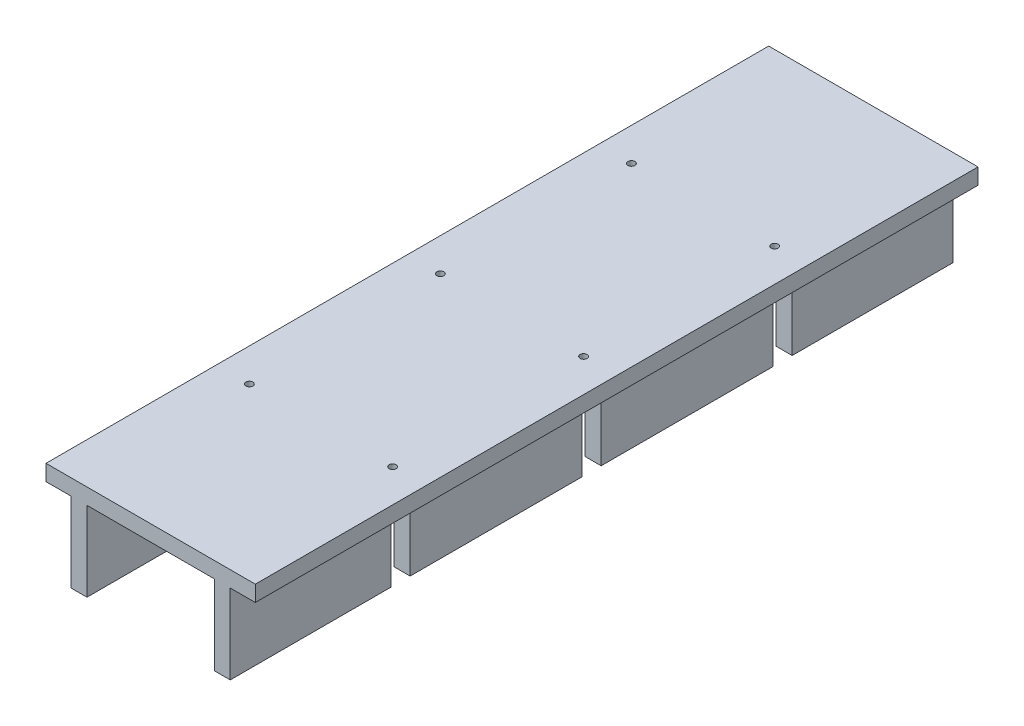
from build123d import *

# Parameters (mm, degrees)
BOSS_EXTRUDE1_DEPTH = 288.29
CUT_EXTRUDE2_REACH  = 301.942
SKETCH4_W           = 7.62
SKETCH4_H           = 23.8125
LPATTERN1_COUNT     = 3
LPATTERN1_PITCH     = 76.2
SKETCH5_R           = 1.3890625
CUT_EXTRUDE3_DEPTH  = 14.2875
LPATTERN2_COUNT     = 3
LPATTERN2_PITCH     = 76.2


with BuildPart() as part:
    # Sketch1 → Boss-Extrude1 (new body)
    with BuildSketch(Plane.XY):
        Polygon((57.15, 0), (57.15, 31.75), (6.35, 31.75), (6.35, 0), (0, 0), (0, 31.75), (-10, 31.75), (-10, 38.1), (0, 38.1), (63.5, 38.1), (73.5, 38.1), (73.5, 31.75), (63.5, 31.75), (63.5, 9.525), (63.5, 0), align=None)
    extrude(amount=BOSS_EXTRUDE1_DEPTH)

    # Cut-Extrude2: up to this face of the body (flat: up to its plane)
    cut_extrude2_end = Plane(part.part.faces().sort_by_distance((0, 15.875, 144.145))[0])
    # Sketch4 → Cut-Extrude2 (cut, up to the picked face)
    with BuildSketch(Plane(origin=(63.5, 0, 0), x_dir=(0, 0, -1), z_dir=(1, 0, 0)), mode=Mode.PRIVATE) as cut_extrude2_sk1:
        with Locations((-220.345, 11.90625)):
            Rectangle(SKETCH4_W, SKETCH4_H)
    cut_extrude2_tool1 = split(extrude(cut_extrude2_sk1.sketch, amount=-CUT_EXTRUDE2_REACH, mode=Mode.PRIVATE), bisect_by=cut_extrude2_end, keep=Keep.BOTH, mode=Mode.PRIVATE)
    cut_extrude2 = cut_extrude2_tool1.solids().sort_by(Axis((63.5, 11.90625, 220.345), (-1, 0, 0)))[0]
    add(cut_extrude2, mode=Mode.SUBTRACT)

    # LPattern1: Cut-Extrude2 ×3
    with Locations(*[(0, 0, -i * LPATTERN1_PITCH) for i in range(1, LPATTERN1_COUNT)]):
        add(cut_extrude2, mode=Mode.SUBTRACT)

    # Sketch5 → Cut-Extrude3 (cut)
    with BuildSketch(Plane(origin=(0, 38.1, 0), x_dir=(1, 0, 0), z_dir=(0, 1, 0))):
        with Locations(Location((60.325, -220.345, 0), (0, 0, 270))):
            Circle(SKETCH5_R)
        with Locations(Location((3.175, -220.345, 0), (0, 0, 270))):
            Circle(SKETCH5_R)
    cut_extrude3 = extrude(amount=-CUT_EXTRUDE3_DEPTH, mode=Mode.SUBTRACT)

    # LPattern2: Cut-Extrude3 ×3
    with Locations(*[(0, 0, -i * LPATTERN2_PITCH) for i in range(1, LPATTERN2_COUNT)]):
        add(cut_extrude3, mode=Mode.SUBTRACT)


solid = part.part
